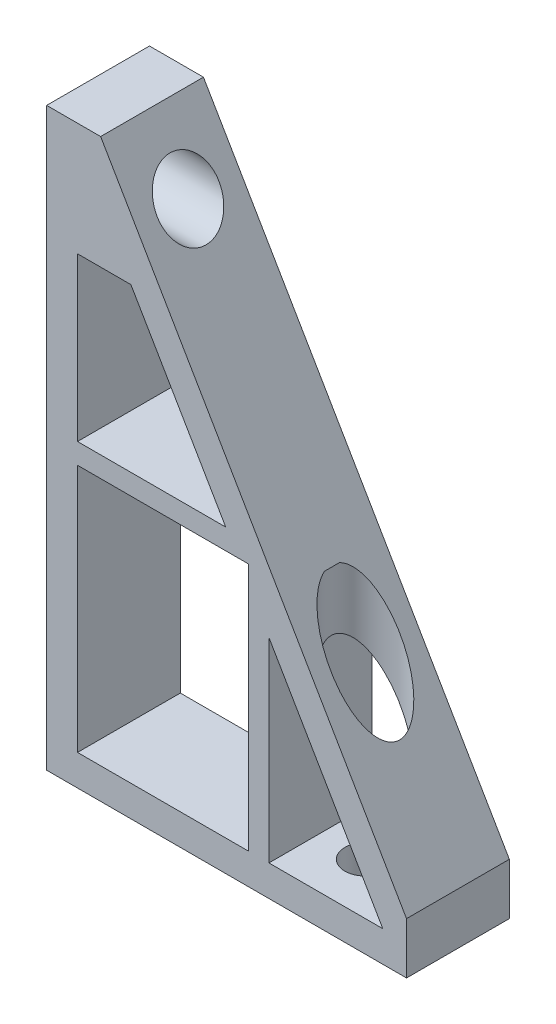
from build123d import *

# Parameters (mm, degrees)
BOSS_EXTRUDE1_DEPTH     = 12.7
CUT_EXTRUDE1_DEPTH      = 26.162
CUT_EXTRUDE1_DEPTH_BACK = 25.4
SKETCH3_W               = 21.105033739
SKETCH3_H               = 30.717467856
SKETCH4_R               = 2.54
CUT_EXTRUDE2_DEPTH      = 50.8
SKETCH9_R               = 4.2291
CUT_EXTRUDE3_DEPTH      = 29.21
SKETCH11_R              = 3.81
CUT_EXTRUDE4_DEPTH      = 12.7
SKETCH12_R              = 2.54
CUT_EXTRUDE5_DEPTH      = 12.7


with BuildPart() as part:
    # Sketch1 → Boss-Extrude1 (new body)
    with BuildSketch(Plane.XY):
        Polygon((0, 0), (44.45, 0), (44.45, 6.35), (0, 82.55), align=None)
    extrude(amount=BOSS_EXTRUDE1_DEPTH)

    # Sketch3 → Cut-Extrude1 (cut, two sides: drawn at the far end of the back side and taken through both)
    with BuildSketch(Plane.XY.offset(-CUT_EXTRUDE1_DEPTH_BACK)):
        Polygon((3.81, 37.067467856), (22.120626117, 37.067467856), (10.4058157, 57.15), (3.81, 57.15), align=None)
        with Locations((14.36251687, 19.168733928)):
            Rectangle(SKETCH3_W, SKETCH3_H)
        Polygon((27.455033739, 3.81), (41.5208157, 3.81), (27.455033739, 27.922769076), align=None)
        Polygon((6.6675, 71.12), (0, 71.12), (0, 82.55), align=None)
    extrude(amount=CUT_EXTRUDE1_DEPTH + CUT_EXTRUDE1_DEPTH_BACK, mode=Mode.SUBTRACT)

    # Sketch4 → Cut-Extrude2 (cut)
    with BuildSketch(Plane.XZ):
        with Locations((33.02, 6.35)):
            Circle(SKETCH4_R)
    extrude(amount=-CUT_EXTRUDE2_DEPTH, mode=Mode.SUBTRACT)

    # Sketch9 → Cut-Extrude3 (cut)
    with BuildSketch(Plane(origin=(0, 3.81, 0), x_dir=(1, 0, 0), z_dir=(0, 1, 0))):
        with Locations((33.02, -6.35)):
            Circle(SKETCH9_R)
    extrude(amount=CUT_EXTRUDE3_DEPTH, mode=Mode.SUBTRACT)

    # Sketch11 → Cut-Extrude4 (cut)
    with BuildSketch(Plane(origin=(3.81, 0, 0), x_dir=(0, 0, -1), z_dir=(1, 0, 0))):
        with Locations((-6.35, 63.5)):
            Circle(SKETCH11_R)
    extrude(amount=CUT_EXTRUDE4_DEPTH, mode=Mode.SUBTRACT)

    # Sketch12 → Cut-Extrude5 (cut)
    with BuildSketch(Plane(origin=(3.81, 0, 0), x_dir=(0, 0, -1), z_dir=(1, 0, 0))):
        with Locations((-6.35, 63.5)):
            Circle(SKETCH12_R)
    extrude(amount=-CUT_EXTRUDE5_DEPTH, mode=Mode.SUBTRACT)


solid = part.part
